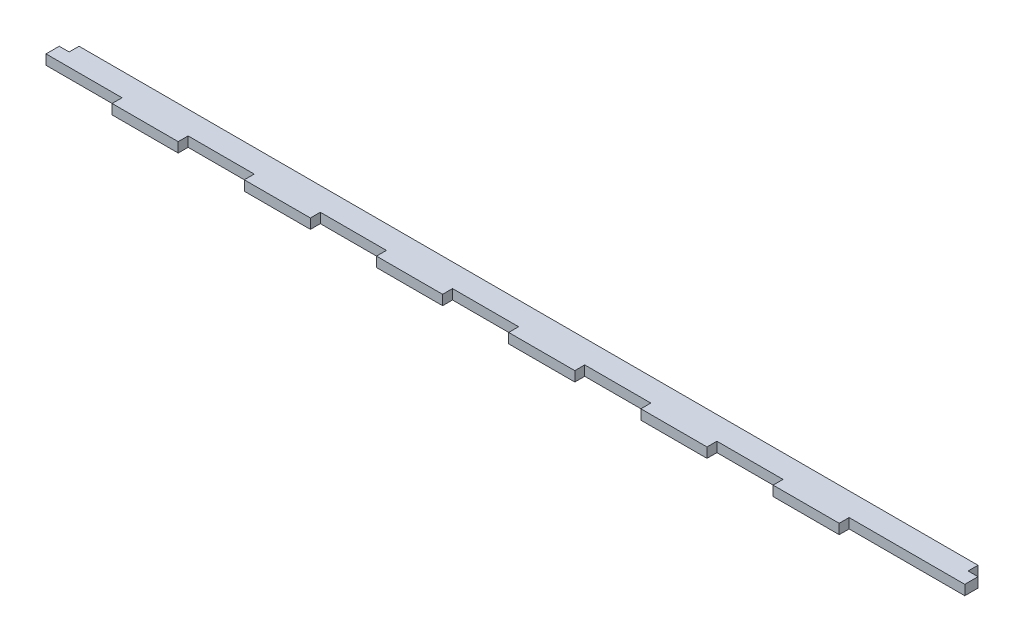
from build123d import *

# Parameters (mm, degrees)
CROQUIS1_W              = 544
CROQUIS1_H              = 20
SALIENTE_EXTRUIR1_DEPTH = 6
CROQUIS3_W              = 40
CROQUIS3_H              = 6
CORTAR_EXTRUIR1_DEPTH   = 6
MATRIZL1_COUNT          = 7
MATRIZL1_PITCH          = 80
CROQUIS4_W              = 24
CROQUIS4_H              = 6
CORTAR_EXTRUIR2_DEPTH   = 6
CROQUIS5_W              = 6
CROQUIS5_H              = 8
SALIENTE_EXTRUIR3_DEPTH = 6


with BuildPart() as part:
    # Croquis1 → Saliente-Extruir1 (new body)
    with BuildSketch(Plane(origin=(0, 0, 0), x_dir=(1, 0, 0), z_dir=(0, 1, 0))):
        with Locations((272, 10)):
            Rectangle(CROQUIS1_W, CROQUIS1_H)
    extrude(amount=SALIENTE_EXTRUIR1_DEPTH)

    # Croquis3 → Cortar-Extruir1 (cut)
    with BuildSketch(Plane(origin=(0, 0, 0), x_dir=(1, 0, 0), z_dir=(0, 1, 0))):
        with Locations((20, 3)):
            Rectangle(CROQUIS3_W, CROQUIS3_H)
    cortar_extruir1 = extrude(amount=CORTAR_EXTRUIR1_DEPTH, mode=Mode.SUBTRACT)

    # MatrizL1: Cortar-Extruir1 ×7
    with Locations(*[(i * MATRIZL1_PITCH, 0, 0) for i in range(1, MATRIZL1_COUNT)]):
        add(cortar_extruir1, mode=Mode.SUBTRACT)

    # Croquis4 → Cortar-Extruir2 (cut)
    with BuildSketch(Plane(origin=(0, 6, 0), x_dir=(1, 0, 0), z_dir=(0, 1, 0))):
        with Locations((532, 3)):
            Rectangle(CROQUIS4_W, CROQUIS4_H)
    extrude(amount=-CORTAR_EXTRUIR2_DEPTH, mode=Mode.SUBTRACT)

    # Croquis5 → Saliente-Extruir3 (add)
    with BuildSketch(Plane(origin=(0, 0, 0), x_dir=(1, 0, 0), z_dir=(0, 1, 0))):
        with Locations((-3, 10)):
            Rectangle(CROQUIS5_W, CROQUIS5_H)
        with Locations((547, 10)):
            Rectangle(CROQUIS5_W, CROQUIS5_H)
    extrude(amount=SALIENTE_EXTRUIR3_DEPTH)


solid = part.part
